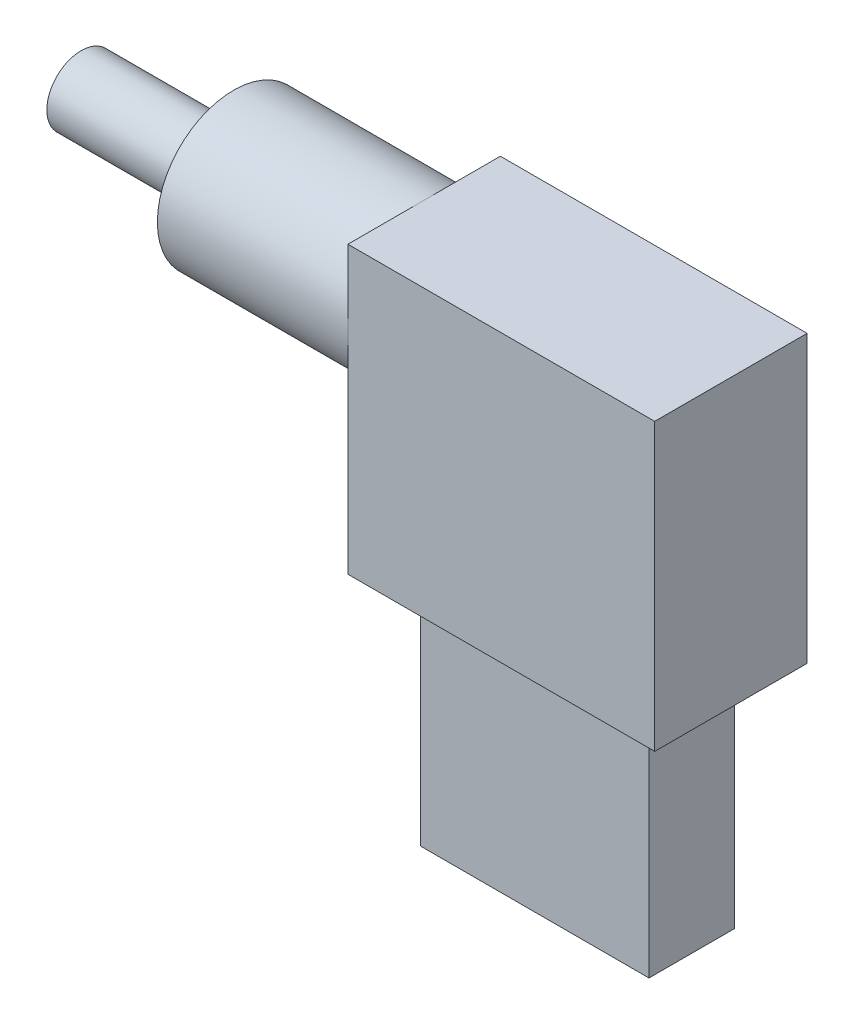
from build123d import *

# Parameters (mm, degrees)
ESQUISSE1_W        = 12
ESQUISSE1_H        = 4.5
ESQUISSE1_W_2      = 11.4
ESQUISSE1_H_2      = 3.9
ESQUISSE1_H_3      = 2
BOSS_EXTRU_1_DEPTH = 12.2
ESQUISSE2_W        = 16.1
ESQUISSE2_H        = 8
BOSS_EXTRU_2_DEPTH = 15
ESQUISSE3_R        = 4
BOSS_EXTRU_3_DEPTH = 10
ESQUISSE4_R        = 1.8
BOSS_EXTRU_4_DEPTH = 8


with BuildPart() as part:
    # Esquisse1 → Boss.-Extru.1 (new body)
    # profile 1 of 2: a face of its own
    with BuildSketch(Plane(origin=(0, 0, 0), x_dir=(1, 0, 0), z_dir=(0, 1, 0))):
        Rectangle(ESQUISSE1_W, ESQUISSE1_H)
        Rectangle(ESQUISSE1_W_2, ESQUISSE1_H_2, mode=Mode.SUBTRACT)
    # profile 2 of 2: a face of its own
    with BuildSketch(Plane(origin=(0, 0, 0), x_dir=(1, 0, 0), z_dir=(0, 1, 0))):
        with Locations((0, -0.95)):
            Rectangle(ESQUISSE1_W_2, ESQUISSE1_H_3)
    extrude(amount=BOSS_EXTRU_1_DEPTH)

    # Esquisse2 → Boss.-Extru.2 (add)
    with BuildSketch(Plane(origin=(0, 12.2, 0), x_dir=(1, 0, 0), z_dir=(0, 1, 0))):
        Rectangle(ESQUISSE2_W, ESQUISSE2_H)
    extrude(amount=BOSS_EXTRU_2_DEPTH)

    # Esquisse3 → Boss.-Extru.3 (add)
    with BuildSketch(Plane.ZY.offset(8.05)):
        with Locations((0, 23.2)):
            Circle(ESQUISSE3_R)
    extrude(amount=BOSS_EXTRU_3_DEPTH)

    # Esquisse4 → Boss.-Extru.4 (add)
    with BuildSketch(Plane.ZY.offset(18.05)):
        with Locations((0, 23.2)):
            Circle(ESQUISSE4_R)
    extrude(amount=BOSS_EXTRU_4_DEPTH)


solid = part.part
